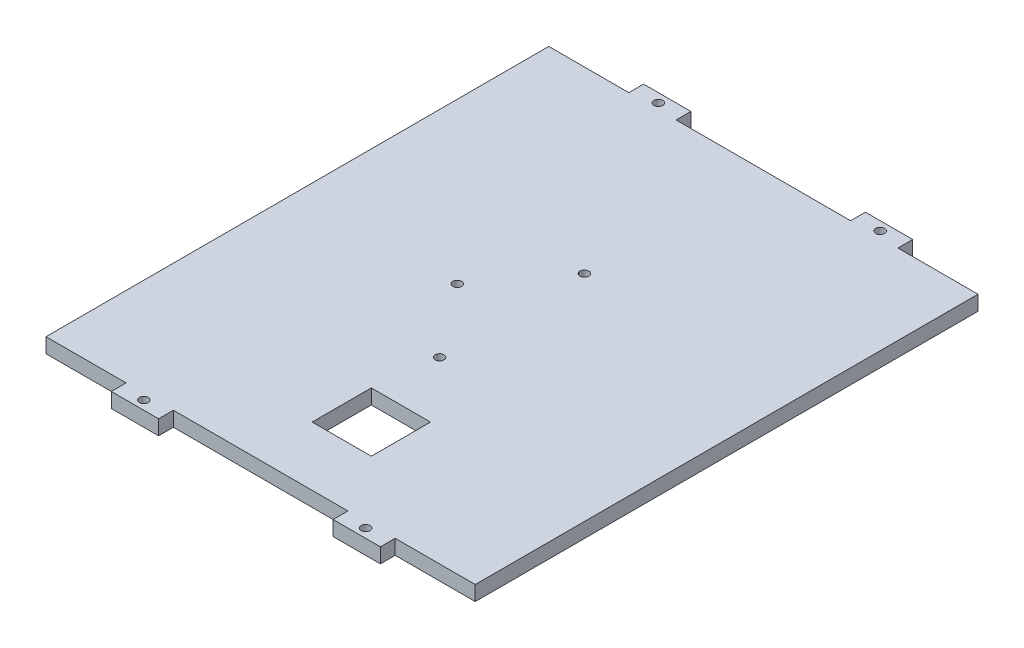
from build123d import *

# Parameters (mm, degrees)
CROQUIS1_W                = 145.14
CROQUIS1_H                = 180
SALIENTE_EXTRUIR1_DEPTH   = 5
CROQUIS2_W                = 59
CROQUIS2_H                = 5
CROQUIS2_W_2              = 27.07
CORTAR_EXTRUIR1_DEPTH     = 116.721237895
CROQUIS3_R                = 1.5
CORTAR_EXTRUIR2_DEPTH     = 116.721237895
SIMETR_A3_COPY_1_SKETCH_R = 1.5
SIMETR_A3_COPY_1_DEPTH    = 116.721237895
CROQUIS4_R                = 1.5
CORTAR_EXTRUIR3_DEPTH     = 116.721237895
CROQUIS5_W                = 20
CROQUIS5_H                = 20
CORTAR_EXTRUIR4_DEPTH     = 116.721237895


with BuildPart() as part:
    # Croquis1 → Saliente-Extruir1 (new body)
    with BuildSketch(Plane(origin=(0, 0, 0), x_dir=(1, 0, 0), z_dir=(0, 1, 0))):
        Rectangle(CROQUIS1_W, CROQUIS1_H)
    extrude(amount=SALIENTE_EXTRUIR1_DEPTH)

    # Croquis2 → Cortar-Extruir1 (cut, through all)
    with BuildSketch(Plane(origin=(0, 5, 0), x_dir=(1, 0, 0), z_dir=(0, 1, 0))):
        with Locations((0, 87.5)):
            Rectangle(CROQUIS2_W, CROQUIS2_H)
        with Locations((-59.035, 87.5)):
            Rectangle(CROQUIS2_W_2, CROQUIS2_H)
        with Locations((59.035, 87.5)):
            Rectangle(CROQUIS2_W_2, CROQUIS2_H)
    cortar_extruir1 = extrude(amount=-CORTAR_EXTRUIR1_DEPTH, mode=Mode.SUBTRACT)

    # Simetría1: Cortar-Extruir1 across plane
    add(cortar_extruir1.mirror(Plane.XY), mode=Mode.SUBTRACT)

    # Croquis3 → Cortar-Extruir2 (cut, through all)
    with BuildSketch(Plane(origin=(0, 5, 0), x_dir=(1, 0, 0), z_dir=(0, 1, 0))):
        with Locations(Location((-37.5, 87, 0), (0, 0, 270))):
            Circle(CROQUIS3_R)
    cortar_extruir2 = extrude(amount=-CORTAR_EXTRUIR2_DEPTH, mode=Mode.SUBTRACT)

    # Simetría2: Cortar-Extruir2 across plane
    add(cortar_extruir2.mirror(Plane(origin=(0, 0, 0), x_dir=(0, 0, 1), z_dir=(1, 0, 0))), mode=Mode.SUBTRACT)

    # Simetría3: Cortar-Extruir2 across plane
    add(cortar_extruir2.mirror(Plane.XY), mode=Mode.SUBTRACT)

    # Simetría3 copy 1 sketch → Simetría3 copy 1 (cut, through all)
    with BuildSketch(Plane(origin=(0, 5, 0), x_dir=(-1, 0, 0), z_dir=(0, 1, 0))):
        with Locations(Location((-37.5, 87, 0), (0, 0, 270))):
            Circle(SIMETR_A3_COPY_1_SKETCH_R)
    extrude(amount=-SIMETR_A3_COPY_1_DEPTH, mode=Mode.SUBTRACT)

    # Croquis4 → Cortar-Extruir3 (cut, through all)
    with BuildSketch(Plane(origin=(0, 5, 0), x_dir=(1, 0, 0), z_dir=(0, 1, 0))):
        with Locations(Location((0, 24.5, 0), (0, 0, 270))):
            Circle(CROQUIS4_R)
        with Locations(Location((0, -24.5, 0), (0, 0, 270))):
            Circle(CROQUIS4_R)
        with Locations(Location((-18.5, 0, 0), (0, 0, 270))):
            Circle(CROQUIS4_R)
    extrude(amount=-CORTAR_EXTRUIR3_DEPTH, mode=Mode.SUBTRACT)

    # Croquis5 → Cortar-Extruir4 (cut, through all)
    with BuildSketch(Plane(origin=(0, 5, 0), x_dir=(1, 0, 0), z_dir=(0, 1, 0))):
        with Locations((7.43, -55)):
            Rectangle(CROQUIS5_W, CROQUIS5_H)
    extrude(amount=-CORTAR_EXTRUIR4_DEPTH, mode=Mode.SUBTRACT)


solid = part.part
